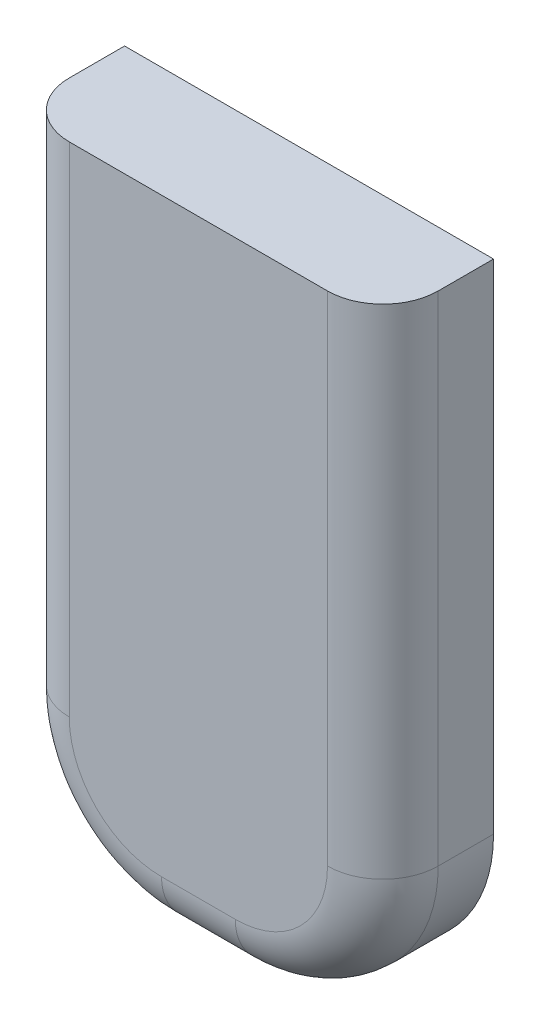
from build123d import *

# Parameters (mm, degrees)
BOSS_EXTRUDE1_DEPTH = 6
FILLET1_R           = 3
SKETCH2_R           = 7.5
CUT_EXTRUDE1_DEPTH  = 4


with BuildPart() as part:
    # Sketch1 → Boss-Extrude1 (new body)
    with BuildSketch(Plane.XY):
        with BuildLine():
            Line((58.585871194, -125), (78.585871194, -125))
            Line((78.585871194, -125), (78.585871194, -152))
            ThreePointArc((78.585871194, -152), (76.242725443, -157.656854249), (70.585871194, -160))
            Line((70.585871194, -160), (66.585871194, -160))
            ThreePointArc((66.585871194, -160), (60.929016944, -157.656854249), (58.585871194, -152))
            Line((58.585871194, -152), (58.585871194, -125))
        make_face()
    extrude(amount=BOSS_EXTRUDE1_DEPTH)

    # Fillet1
    fillet1_edges = [part.edges().sort_by_distance(p)[0] for p in [
        (68.585871194, -160, 6),
        (76.242725443, -157.656854249, 6),
        (78.585871194, -138.5, 6),
        (58.585871194, -138.5, 6),
        (60.929016944, -157.656854249, 6),
    ]]
    fillet(fillet1_edges, radius=FILLET1_R)

    # Sketch2 → Cut-Extrude1 (cut)
    with BuildSketch(Plane(origin=(0, 0, 0), x_dir=(-1, 0, 0), z_dir=(0, 0, -1))):
        with Locations((-68.585871194, -149)):
            Circle(SKETCH2_R)
    extrude(amount=-CUT_EXTRUDE1_DEPTH, mode=Mode.SUBTRACT)


solid = part.part
